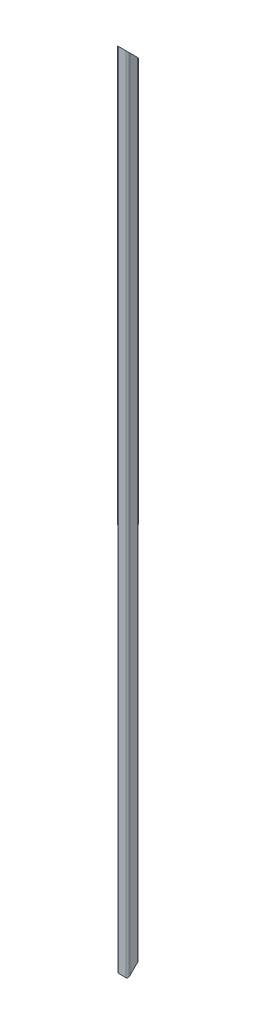
from build123d import *

# Parameters (mm, degrees)
EXTRUDE_1_DEPTH     = 4240
CUT_EXTRUDE_1_DEPTH = 4241.530627174


with BuildPart() as part:
    # Эскиз1 → Бобышка-Вытянуть1 (new body)
    with BuildSketch(Plane(origin=(0, 0, 0), x_dir=(1, 0, 0), z_dir=(0, 1, 0))):
        with BuildLine():
            Line((-20, 30), (20, 30))
            ThreePointArc((20, 30), (27.071067812, 27.071067812), (30, 20))
            Line((30, 20), (30, -20))
            ThreePointArc((30, -20), (27.071067812, -27.071067812), (20, -30))
            Line((20, -30), (-20, -30))
            ThreePointArc((-20, -30), (-27.071067812, -27.071067812), (-30, -20))
            Line((-30, -20), (-30, 20))
            ThreePointArc((-30, 20), (-27.071067812, 27.071067812), (-20, 30))
        make_face()
        with BuildLine():
            Line((-16, 26), (16, 26))
            ThreePointArc((16, 26), (23.071067812, 23.071067812), (26, 16))
            Line((26, 16), (26, -16))
            ThreePointArc((26, -16), (23.071067812, -23.071067812), (16, -26))
            Line((16, -26), (-16, -26))
            ThreePointArc((-16, -26), (-23.071067812, -23.071067812), (-26, -16))
            Line((-26, -16), (-26, 16))
            ThreePointArc((-26, 16), (-23.071067812, 23.071067812), (-16, 26))
        make_face(mode=Mode.SUBTRACT)
    extrude(amount=EXTRUDE_1_DEPTH)

    # Эскиз2 → Вырез-Вытянуть1 (cut, through all)
    with BuildSketch(Plane(origin=(30, 0, 0), x_dir=(0, 0, -1), z_dir=(1, 0, 0))):
        Polygon((-30, 0), (30, 0), (30, 60), align=None)
        Polygon((-30, 4240), (30, 4240), (30, 4180), align=None)
    extrude(amount=-CUT_EXTRUDE_1_DEPTH, mode=Mode.SUBTRACT)


solid = part.part
